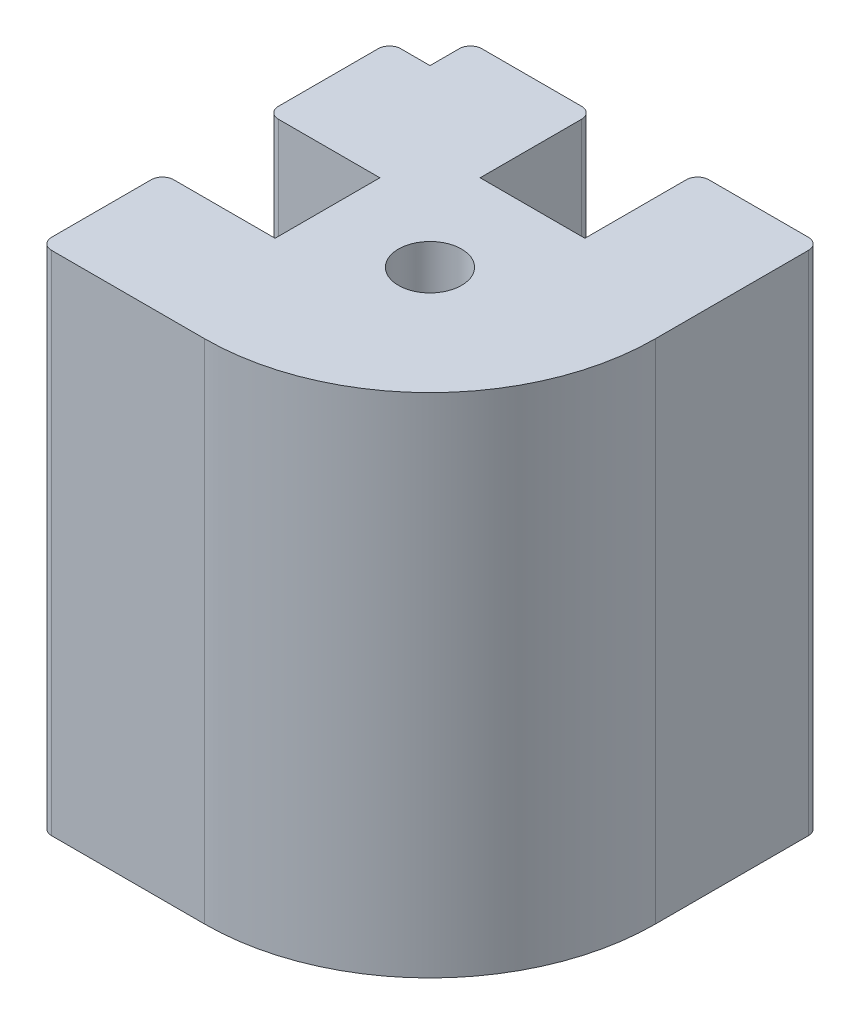
from build123d import *

# Parameters (mm, degrees)
SKETCH1_R           = 2.8
BOSS_EXTRUDE1_DEPTH = 45
FILLET1_R           = 1
FILLET2_R           = 20


with BuildPart() as part:
    # Sketch1 → Boss-Extrude1 (new body)
    with BuildSketch(Plane(origin=(0, 0, 0), x_dir=(1, 0, 0), z_dir=(0, 1, 0))):
        Polygon((-19.099152542, -15.5), (-19.099152542, -4.65), (-9.099152542, -4.65), (-9.099152542, 4.65), (-19.099152542, 4.65), (-19.099152542, 15.5), (-15.5, 15.5), (-15.5, 19.099152542), (-4.65, 19.099152542), (-4.65, 9.099152542), (4.65, 9.099152542), (4.65, 19.099152542), (15.5, 19.099152542), (15.5, -15.5), align=None)
        with Locations(Location((0, 0, 0), (0, 0, 90))):
            Circle(SKETCH1_R, mode=Mode.SUBTRACT)
    extrude(amount=BOSS_EXTRUDE1_DEPTH)

    # Fillet1
    fillet1_edges = [part.edges().sort_by_distance(p)[0] for p in [
        (-19.099152542, 22.5, 15.5),
        (-19.099152542, 22.5, 4.65),
        (-19.099152542, 22.5, -4.65),
        (-19.099152542, 22.5, -15.5),
        (-15.5, 22.5, -19.099152542),
        (-4.65, 22.5, -19.099152542),
        (4.65, 22.5, -19.099152542),
        (15.5, 22.5, -19.099152542),
    ]]
    fillet(fillet1_edges, radius=FILLET1_R)

    # Fillet2
    fillet2_edges = [part.edges().sort_by_distance(p)[0] for p in [
        (15.5, 22.5, 15.5),
    ]]
    fillet(fillet2_edges, radius=FILLET2_R)


solid = part.part
